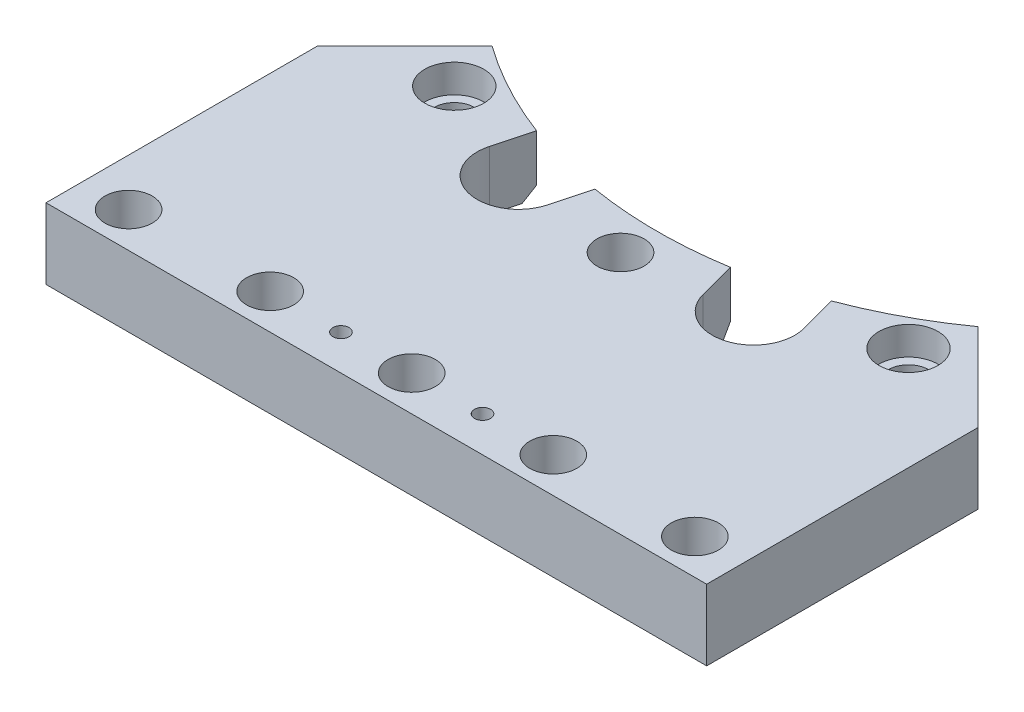
from build123d import *

# Parameters (mm, degrees)
SKETCH_1_R             = 10
SKETCH_1_R_2           = 8.5
EXTRUDE_1_DEPTH        = 30
SKETCH_3_R             = 12.5
CUT_EXTRUDE_1_DEPTH    = 12
CUT_EXTRUDE_2_REACH    = 210.839
SKETCH_4_R             = 6.5
SKETCH_5_R             = 10
CUT_EXTRUDE_3_DEPTH    = 16
PATTERN_LINEAR_1_COUNT = 5
PATTERN_LINEAR_1_PITCH = 60
CUT_EXTRUDE_4_REACH    = 210.839
SKETCH_6_R             = 3.4
CUT_EXTRUDE_5_DEPTH    = 5
CHAMFER_1_SIZE         = 5


with BuildPart() as part:
    # 草图1 → 凸台-拉伸1 (new body)
    with BuildSketch(Plane(origin=(0, 0, 0), x_dir=(1, 0, 0), z_dir=(0, 1, 0))):
        with BuildLine():
            Line((-140, 0), (140, 0))
            Line((140, 0), (140, 115))
            Line((140, 115), (102.967607088, 152.032392912))
            ThreePointArc((102.967607088, 152.032392912), (83.433104198, 139.897735045), (62.490215343, 130.398149206))
            Line((62.490215343, 130.398149206), (66.726368142, 114.588611729))
            ThreePointArc((66.726368142, 114.588611729), (54.351999472, 93.155576479), (32.918964222, 105.52994515))
            Line((32.918964222, 105.52994515), (28.682811422, 121.339482627))
            ThreePointArc((28.682811422, 121.339482627), (0, 119), (-28.682811422, 121.339482627))
            Line((-28.682811422, 121.339482627), (-32.918964222, 105.52994515))
            ThreePointArc((-32.918964222, 105.52994515), (-54.351999472, 93.155576479), (-66.726368142, 114.588611729))
            Line((-66.726368142, 114.588611729), (-62.490215343, 130.398149206))
            ThreePointArc((-62.490215343, 130.398149206), (-83.433104198, 139.897735045), (-102.967607088, 152.032392912))
            Line((-102.967607088, 152.032392912), (-140, 115))
            Line((-140, 115), (-140, 0))
        make_face()
        with Locations(Location((0, 103.5, 0), (0, 0, 270))):
            Circle(SKETCH_1_R, mode=Mode.SUBTRACT)
        with Locations(Location((-96.25, 129.290109771, 0), (0, 0, 270))):
            Circle(SKETCH_1_R_2, mode=Mode.SUBTRACT)
        with Locations(Location((96.25, 129.290109771, 0), (0, 0, 90))):
            Circle(SKETCH_1_R_2, mode=Mode.SUBTRACT)
    extrude(amount=EXTRUDE_1_DEPTH)

    # 草图3 → 切除-拉伸1 (cut)
    with BuildSketch(Plane(origin=(0, 30, 0), x_dir=(1, 0, 0), z_dir=(0, 1, 0))):
        with Locations(Location((-96.25, 129.290109771, 0), (0, 0, 270))):
            Circle(SKETCH_3_R)
        with Locations(Location((96.25, 129.290109771, 0), (0, 0, 270))):
            Circle(SKETCH_3_R)
    extrude(amount=-CUT_EXTRUDE_1_DEPTH, mode=Mode.SUBTRACT)

    # 草图4 → 切除-拉伸2 (cut, up to next)
    with BuildSketch(Plane(origin=(0, 30, 0), x_dir=(1, 0, 0), z_dir=(0, 1, 0)), mode=Mode.PRIVATE) as cut_extrude_2_sk1:
        with Locations(Location((-120, 15, 0), (0, 0, 270))):
            Circle(SKETCH_4_R)
    cut_extrude_2_tool1 = extrude(cut_extrude_2_sk1.sketch, amount=-CUT_EXTRUDE_2_REACH, mode=Mode.PRIVATE) & part.part
    cut_extrude_2 = cut_extrude_2_tool1.solids().sort_by_distance((-120, 30, -15))[0]
    add(cut_extrude_2, mode=Mode.SUBTRACT)

    # 草图5 → 切除-拉伸3 (cut)
    with BuildSketch(Plane(origin=(0, 30, 0), x_dir=(1, 0, 0), z_dir=(0, 1, 0))):
        with Locations(Location((-120, 15, 0), (0, 0, 270))):
            Circle(SKETCH_5_R)
    cut_extrude_3 = extrude(amount=-CUT_EXTRUDE_3_DEPTH, mode=Mode.SUBTRACT)

    # 阵列(线性)1: 切除-拉伸2, 切除-拉伸3 ×5
    with Locations(*[(i * PATTERN_LINEAR_1_PITCH, 0, 0) for i in range(1, PATTERN_LINEAR_1_COUNT)]):
        add(cut_extrude_2, mode=Mode.SUBTRACT)
        add(cut_extrude_3, mode=Mode.SUBTRACT)

    # 草图6 → 切除-拉伸4 (cut, up to next)
    with BuildSketch(Plane(origin=(0, 30, 0), x_dir=(1, 0, 0), z_dir=(0, 1, 0)), mode=Mode.PRIVATE) as cut_extrude_4_sk1:
        with Locations(Location((-30, 15, 0), (0, 0, 270))):
            Circle(SKETCH_6_R)
    cut_extrude_4_tool1 = extrude(cut_extrude_4_sk1.sketch, amount=-CUT_EXTRUDE_4_REACH, mode=Mode.PRIVATE) & part.part
    # 草图6 → 切除-拉伸4 (cut, up to next)
    with BuildSketch(Plane(origin=(0, 30, 0), x_dir=(1, 0, 0), z_dir=(0, 1, 0)), mode=Mode.PRIVATE) as cut_extrude_4_sk2:
        with Locations(Location((30, 15, 0), (0, 0, 90))):
            Circle(SKETCH_6_R)
    cut_extrude_4_tool2 = extrude(cut_extrude_4_sk2.sketch, amount=-CUT_EXTRUDE_4_REACH, mode=Mode.PRIVATE) & part.part
    add(cut_extrude_4_tool1.solids().sort_by_distance((-30, 30, -15))[0], mode=Mode.SUBTRACT)
    add(cut_extrude_4_tool2.solids().sort_by_distance((30, 30, -15))[0], mode=Mode.SUBTRACT)

    # 草图7 → 切除-拉伸5 (cut)
    with BuildSketch(Plane.XZ):
        with BuildLine():
            Line((131.566597253, -123.433402747), (131.566597253, -152.032392912))
            Line((131.566597253, -152.032392912), (-131.566597253, -152.032392912))
            Line((-131.566597253, -152.032392912), (-131.566597253, -123.433402747))
            ThreePointArc((-131.566597253, -123.433402747), (0, -79), (131.566597253, -123.433402747))
        make_face()
    extrude(amount=-CUT_EXTRUDE_5_DEPTH, mode=Mode.SUBTRACT)

    # 倒角1
    chamfer_1_edges = [part.edges().sort_by_distance(p)[0] for p in [
        (83.433104198, 5, -139.897735045),
        (-83.433104198, 5, -139.897735045),
        (0, 5, -119),
    ]]
    chamfer(chamfer_1_edges, length=CHAMFER_1_SIZE)


solid = part.part
